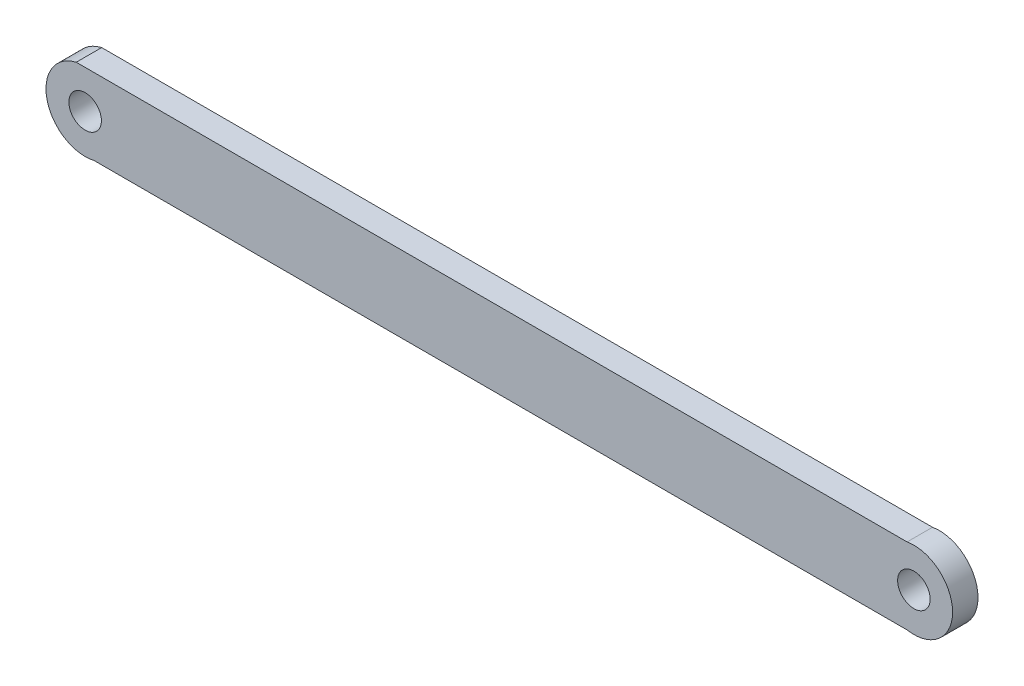
from build123d import *

# Parameters (mm, degrees)
SKETCH1_R      = 2.032
EXTRUDE1_DEPTH = 3.175


with BuildPart() as part:
    # Sketch1 → Extrude1 (new body)
    with BuildSketch(Plane.XY):
        with BuildLine():
            Line((-51.909886978, 4.687617925), (51.909886978, 4.687617925))
            ThreePointArc((51.909886978, 4.687617925), (57.595124639, -0.074882075), (51.909886978, -4.837382075))
            Line((51.909886978, -4.837382075), (-49.690113022, -4.837382075))
            ThreePointArc((-49.690113022, -4.837382075), (-55.5625, -1.184769053), (-51.909886978, 4.687617925))
        make_face()
        with Locations((-50.8, -0.074882075)):
            Circle(SKETCH1_R, mode=Mode.SUBTRACT)
        with Locations((52.757742564, -0.074882075)):
            Circle(SKETCH1_R, mode=Mode.SUBTRACT)
    extrude(amount=EXTRUDE1_DEPTH)


solid = part.part
